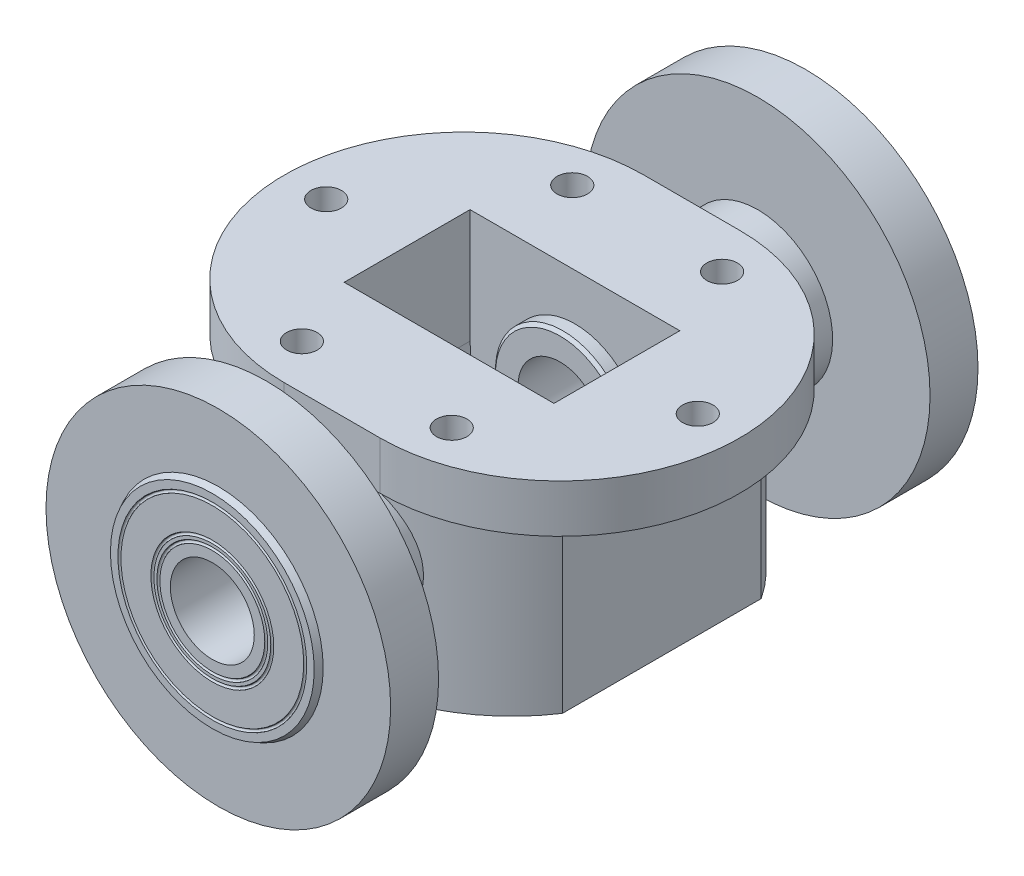
from build123d import *

# Parameters (mm, degrees)
SKETCH_1_R               = 57.5
EXTRUDE_1_DEPTH          = 16
SKETCH_2_R               = 35
SKETCH_3_R               = 34
SKETCH_4_R               = 25
EXTRUDE_2_DEPTH          = 164
EXTRUDE_START            = 16
SKETCH_5_R               = 57.5
EXTRUDE_3_DEPTH          = 16
SKETCH_6_R               = 35
SKETCH_7_R               = 34
SKETCH_8_R               = 50
EXTRUDE_4_DEPTH          = 38
CUT_EXTRUDE_1_DEPTH      = 214.425631161
CUT_EXTRUDE_1_DEPTH_BACK = 214.425631161
SKETCH_10_R              = 19
SKETCH_11_R              = 50
EXTRUDE_5_DEPTH          = 16
HOLE_WIZARD_M12_1_D      = 10.2
HOLE_WIZARD_M12_1_DEPTH  = 12
HOLE_WIZARD_M12_1_TIP    = 3.064389157
CUT_EXTRUDE_2_DEPTH      = 222.545142217
CUT_EXTRUDE_2_DEPTH_BACK = 222.545142217
SKETCH_14_R              = 14
SKETCH_15_R              = 35
CUT_EXTRUDE_3_DEPTH      = 21
EXTRUDE_START_2          = 5
SKETCH_16_R              = 22.5
SKETCH_16_R_2            = 14
EXTRUDE_6_DEPTH          = 5
CHAMFER_1_SIZE           = 1
SWEEP_1_PROFILE_R        = 0.5
SWEEP_2_PROFILE_R        = 0.5
SWEEP_3_PROFILE_R        = 0.5
EXTRUDE_7_REACH          = 221.135
SKETCH_36_R              = 60
SKETCH_36_R_2            = 50
CUT_EXTRUDE_4_DEPTH      = 60


with BuildPart() as part:
    # 草图1 → 凸台-拉伸1 (new body)
    with BuildSketch(Plane.XY):
        Circle(SKETCH_1_R)
    extrude(amount=EXTRUDE_1_DEPTH)

    # 草图2 → 放样1 section 0
    with BuildSketch(Plane.XY.offset(16)):
        Circle(SKETCH_2_R)
    # 草图3 → 放样1 section 1
    with BuildSketch(Plane.XY.offset(18)):
        Circle(SKETCH_3_R)
    loft()

    # 草图4 → 凸台-拉伸2 (add)
    with BuildSketch(Plane(origin=(0, 0, 0), x_dir=(-1, 0, 0), z_dir=(0, 0, -1))):
        Circle(SKETCH_4_R)
    extrude(amount=EXTRUDE_2_DEPTH)

    # 草图5 → 凸台-拉伸3 (add)
    with BuildSketch(Plane(origin=(0, 0, -164), x_dir=(-1, 0, 0), z_dir=(0, 0, -1)).offset(EXTRUDE_START)):
        with Locations(Location((0, 0, 0), (0, 0, 180))):
            Circle(SKETCH_5_R)
    extrude(amount=-EXTRUDE_3_DEPTH)

    # 草图6 → 放样2 section 0
    with BuildSketch(Plane(origin=(0, 0, -180), x_dir=(-1, 0, 0), z_dir=(0, 0, -1))):
        Circle(SKETCH_6_R)
    # 草图7 → 放样2 section 1
    with BuildSketch(Plane(origin=(0, 0, -182), x_dir=(-1, 0, 0), z_dir=(0, 0, -1))):
        Circle(SKETCH_7_R)
    loft()

    # 草图8 → 凸台-拉伸4 (add, symmetric)
    with BuildSketch(Plane(origin=(0, 0, 0), x_dir=(1, 0, 0), z_dir=(0, 1, 0))):
        with Locations(Location((0, 82, 0), (0, 0, 270))):
            Circle(SKETCH_8_R)
    extrude(amount=EXTRUDE_4_DEPTH, both=True)

    # 草图10 → 切除-拉伸1 (cut, two sides: drawn at the far end of the back side and taken through both)
    with BuildSketch(Plane(origin=(0, 38, 0), x_dir=(1, 0, 0), z_dir=(0, 1, 0)).offset(-CUT_EXTRUDE_1_DEPTH_BACK)):
        with Locations(Location((0, 82, 0), (0, 0, 270))):
            Circle(SKETCH_10_R)
    extrude(amount=CUT_EXTRUDE_1_DEPTH + CUT_EXTRUDE_1_DEPTH_BACK, mode=Mode.SUBTRACT)

    # 草图11 → 凸台-拉伸5 (add)
    with BuildSketch(Plane(origin=(0, 38, 0), x_dir=(1, 0, 0), z_dir=(0, 1, 0))):
        with BuildLine():
            Line((-16, 22), (16, 22))
            ThreePointArc((16, 22), (76, 82), (16, 142))
            Line((16, 142), (-16, 142))
            ThreePointArc((-16, 142), (-76, 82), (-16, 22))
        make_face()
        with Locations(Location((0, 82, 0), (0, 0, 76.261741973))):
            Circle(SKETCH_11_R, mode=Mode.SUBTRACT)
    extrude(amount=-EXTRUDE_5_DEPTH)

    # M12 螺纹孔1
    with Locations(Plane(origin=(-62, 38, -82), x_dir=(0, 0, 1), z_dir=(0, 1, 0))):
        with Locations((0, 0), (-45.110974275, 37), (45.110974275, 37), (-45.110974275, 87), (45.110974275, 87), (0, 124)):
            Hole(HOLE_WIZARD_M12_1_D / 2, depth=HOLE_WIZARD_M12_1_DEPTH)
            with Locations((0, 0, -(HOLE_WIZARD_M12_1_DEPTH + HOLE_WIZARD_M12_1_TIP / 2))):  # 118° drill point
                Cone(0, HOLE_WIZARD_M12_1_D / 2, HOLE_WIZARD_M12_1_TIP, mode=Mode.SUBTRACT)

    # 草图14 → 切除-拉伸2 (cut, two sides: drawn at the far end of the back side and taken through both)
    with BuildSketch(Plane(origin=(0, 0, -182), x_dir=(-1, 0, 0), z_dir=(0, 0, -1)).offset(-CUT_EXTRUDE_2_DEPTH_BACK)):
        Circle(SKETCH_14_R)
    extrude(amount=CUT_EXTRUDE_2_DEPTH + CUT_EXTRUDE_2_DEPTH_BACK, mode=Mode.SUBTRACT)

    # 草图15 → 切除-拉伸3 (cut, symmetric)
    with BuildSketch(Plane.XY.offset(-82)):
        Circle(SKETCH_15_R)
        with BuildLine():
            ThreePointArc((-35, 0), (0, 35), (35, 0))
            Line((35, 0), (35, 38))
            Line((35, 38), (-35, 38))
            Line((-35, 38), (-35, 0))
        make_face()
    extrude(amount=CUT_EXTRUDE_3_DEPTH, both=True, mode=Mode.SUBTRACT)

    # 草图16 → 凸台-拉伸6 (add)
    with BuildSketch(Plane(origin=(0, 0, -61), x_dir=(-1, 0, 0), z_dir=(0, 0, -1)).offset(EXTRUDE_START_2)):
        with Locations(Location((0, 0, 0), (0, 0, 180))):
            Circle(SKETCH_16_R)
        Circle(SKETCH_16_R_2, mode=Mode.SUBTRACT)
    extrude_6 = extrude(amount=-EXTRUDE_6_DEPTH)

    # 镜向3: 凸台-拉伸6 across plane
    add(extrude_6.mirror(Plane.XY.offset(-82)))

    # 倒角1
    chamfer_1_edges = [part.edges().sort_by_distance(p)[0] for p in [
        (-22.5, 0, -66),
        (-22.5, 0, -98),
    ]]
    chamfer(chamfer_1_edges, length=CHAMFER_1_SIZE)

    # 切除-扫描1: sweep along a path in 草图17
    with BuildLine(Plane.XY.offset(18)) as sweep_1_path:
        CenterArc((0, 0), 18, 0, 360)
    # 切除-扫描1 profile (on start of the path) → 切除-扫描1 (sweep, cut)
    with BuildSketch(Plane(origin=(18, 0, 18), x_dir=(0, 0, 1), z_dir=(0, 1, 0))):
        Circle(SWEEP_1_PROFILE_R)
    sweep_1 = sweep(path=sweep_1_path.line, mode=Mode.SUBTRACT)

    # 切除-扫描2: sweep along a path in 草图26
    with BuildLine(Plane.XY.offset(18)) as sweep_2_path:
        CenterArc((0, 0), 20, 0, 360)
    # 切除-扫描2 profile (on start of the path) → 切除-扫描2 (sweep, cut)
    with BuildSketch(Plane(origin=(20, 0, 18), x_dir=(0, 0, 1), z_dir=(0, 1, 0))):
        Circle(SWEEP_2_PROFILE_R)
    sweep_2 = sweep(path=sweep_2_path.line, mode=Mode.SUBTRACT)

    # 切除-扫描3: sweep along a path in 草图31
    with BuildLine(Plane.XY.offset(18)) as sweep_3_path:
        CenterArc((0, 0), 31, 0, 360)
    # 切除-扫描3 profile (on start of the path) → 切除-扫描3 (sweep, cut)
    with BuildSketch(Plane(origin=(31, 0, 18), x_dir=(0, 0, 1), z_dir=(0, 1, 0))):
        Circle(SWEEP_3_PROFILE_R)
    sweep_3 = sweep(path=sweep_3_path.line, mode=Mode.SUBTRACT)

    # 草图36 → 凸台-拉伸7 (add, up to next)
    with BuildSketch(Plane.XZ.offset(38), mode=Mode.PRIVATE) as extrude_7_sk1:
        with Locations(Location((0, -82, 0), (0, 0, 270))):
            Circle(SKETCH_36_R)
        with Locations((0, -82)):
            Circle(SKETCH_36_R_2, mode=Mode.SUBTRACT)
    extrude_7_tool1 = extrude(extrude_7_sk1.sketch, amount=-EXTRUDE_7_REACH, mode=Mode.PRIVATE) - part.part
    add(extrude_7_tool1.solids().sort_by_distance((0, -38, -23.697056))[0])

    # 草图37 → 切除-拉伸4 (cut)
    with BuildSketch(Plane.XZ.offset(38)):
        with BuildLine():
            ThreePointArc((60, -82), (57.445626465, -64.679491924), (50, -48.833752096))
            Line((50, -48.833752096), (50, -115.166247904))
            ThreePointArc((50, -115.166247904), (57.445626465, -99.320508076), (60, -82))
        make_face()
        with BuildLine():
            Line((-50, -115.166247904), (-50, -48.833752096))
            ThreePointArc((-50, -48.833752096), (-60, -82), (-50, -115.166247904))
        make_face()
    extrude(amount=-CUT_EXTRUDE_4_DEPTH, mode=Mode.SUBTRACT)

    # 镜向4: 切除-扫描1, 切除-扫描2, 切除-扫描3 across plane
    add(sweep_1.mirror(Plane.XY.offset(-82)), mode=Mode.SUBTRACT)
    add(sweep_2.mirror(Plane.XY.offset(-82)), mode=Mode.SUBTRACT)
    add(sweep_3.mirror(Plane.XY.offset(-82)), mode=Mode.SUBTRACT)


solid = part.part
